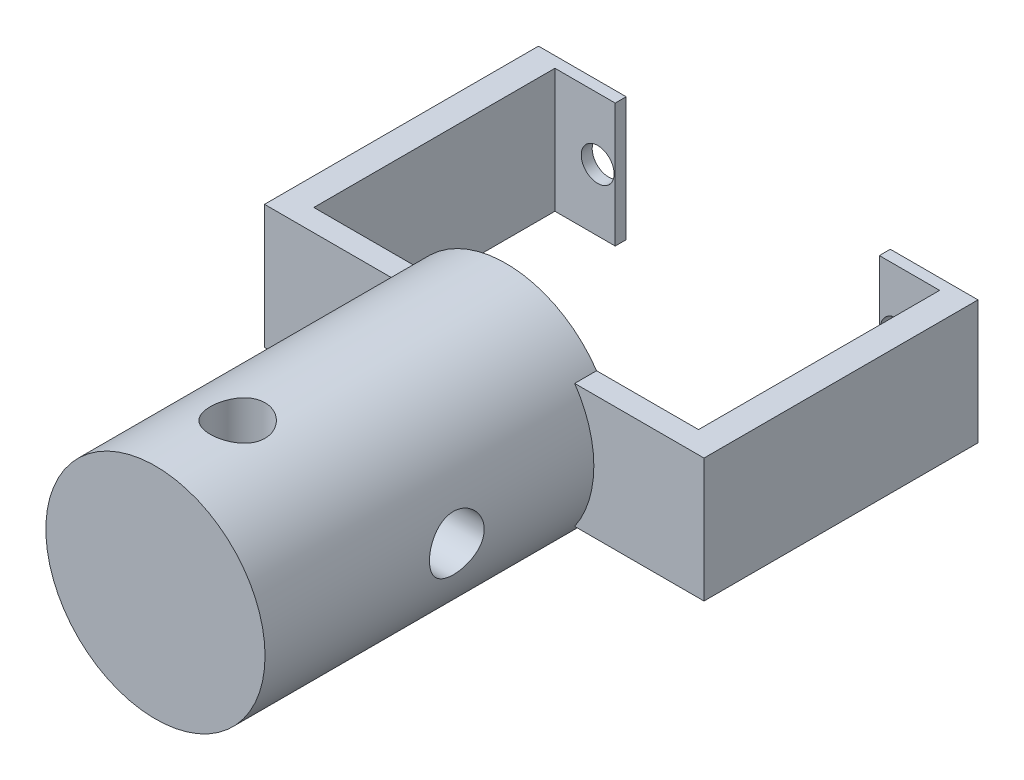
from build123d import *

# Parameters (mm, degrees)
SKETCH_1_R               = 1.5
SKETCH_1_W               = 4
SKETCH_1_H               = 11.3
EXTRUDE_1_DEPTH          = 1
SKETCH_2_W               = 2.5
SKETCH_2_H               = 11.3
EXTRUDE_2_DEPTH          = 22
SKETCH_3_W               = 40.1
SKETCH_3_H               = 11.3
EXTRUDE_3_DEPTH          = 2
SKETCH_4_R               = 10
EXTRUDE_4_DEPTH          = 2
EXTRUDE_START            = 30
SKETCH_6_R               = 10
EXTRUDE_5_DEPTH          = 30
CUT_EXTRUDE_2_DEPTH      = 60.690242084
CUT_EXTRUDE_2_DEPTH_BACK = 60.690242084
SKETCH_8_R               = 2.5
CUT_EXTRUDE_3_DEPTH      = 69.000073623
CUT_EXTRUDE_3_DEPTH_BACK = 69.000073623
SKETCH_9_R               = 2.5


with BuildPart() as part:
    # 草图1 → 凸台-拉伸1 (new body)
    # profile 1 of 4: a face of its own
    with BuildSketch(Plane.XY):
        Polygon((-12.05, -5.65), (-12.05, 0), (-12.05, 5.65), (-16.05, 5.65), (-16.05, -5.65), align=None)
        with Locations((-13.65, 0)):
            Circle(SKETCH_1_R, mode=Mode.SUBTRACT)
    # profile 2 of 4: a face of its own
    with BuildSketch(Plane.XY):
        Polygon((12.05, 5.65), (12.05, 0), (12.05, -5.65), (16.05, -5.65), (16.05, 5.65), align=None)
        with BuildLine():
            ThreePointArc((15.15, 0), (13.65, -1.5), (12.15, 0))
            ThreePointArc((12.15, 0), (13.65, 1.5), (15.15, 0))
        make_face(mode=Mode.SUBTRACT)
    # profile 3 of 4: a face of its own
    with BuildSketch(Plane.XY):
        with Locations((-18.05, 0)):
            Rectangle(SKETCH_1_W, SKETCH_1_H)
    # profile 4 of 4: a face of its own
    with BuildSketch(Plane.XY):
        with Locations((18.05, 0)):
            Rectangle(SKETCH_1_W, SKETCH_1_H)
    extrude(amount=-EXTRUDE_1_DEPTH)

    # 草图2 → 凸台-拉伸2 (add)
    with BuildSketch(Plane.XY):
        with Locations((-18.8, 0)):
            Rectangle(SKETCH_2_W, SKETCH_2_H)
        with Locations((18.8, 0)):
            Rectangle(SKETCH_2_W, SKETCH_2_H)
    extrude(amount=EXTRUDE_2_DEPTH)

    # 草图3 → 凸台-拉伸3 (add)
    with BuildSketch(Plane.XY.offset(22)):
        Rectangle(SKETCH_3_W, SKETCH_3_H)
    extrude(amount=EXTRUDE_3_DEPTH)

    # 草图4 → 凸台-拉伸4 (add)
    with BuildSketch(Plane.XY.offset(24)):
        Circle(SKETCH_4_R)
    extrude(amount=-EXTRUDE_4_DEPTH)

    # 草图6 → 凸台-拉伸5 (add)
    with BuildSketch(Plane.XY.offset(24).offset(EXTRUDE_START)):
        Circle(SKETCH_6_R)
    extrude(amount=-EXTRUDE_5_DEPTH)

    # 草图8 → 切除-拉伸2 (cut, two sides: drawn at the far end of the back side and taken through both)
    with BuildSketch(Plane.XZ.offset(5.65).offset(-CUT_EXTRUDE_2_DEPTH_BACK)):
        with Locations(Location((0, 46.5, 0), (0, 0, 270))):
            Circle(SKETCH_8_R)
    extrude(amount=CUT_EXTRUDE_2_DEPTH + CUT_EXTRUDE_2_DEPTH_BACK, mode=Mode.SUBTRACT)

    # 草图9 → 切除-拉伸3 (cut, two sides: drawn at the far end of the back side and taken through both)
    with BuildSketch(Plane.ZY.offset(20.05).offset(-CUT_EXTRUDE_3_DEPTH_BACK)):
        with Locations(Location((36.5, 0, 0), (0, 0, 270))):
            Circle(SKETCH_9_R)
    extrude(amount=CUT_EXTRUDE_3_DEPTH + CUT_EXTRUDE_3_DEPTH_BACK, mode=Mode.SUBTRACT)


solid = part.part
